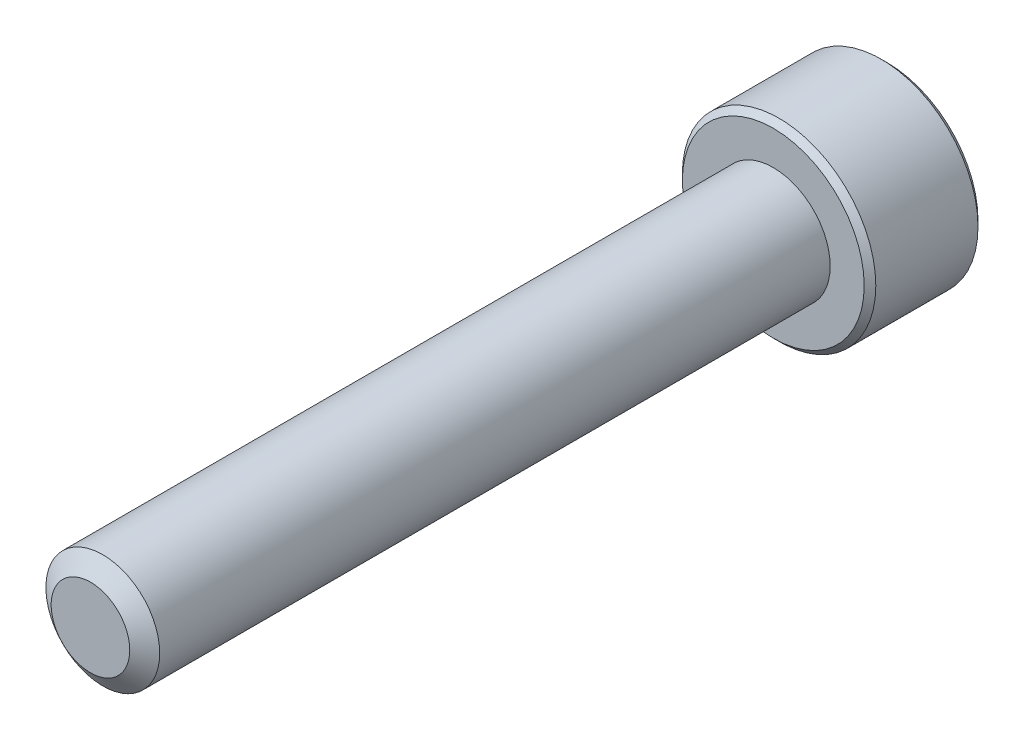
from build123d import *

# Parameters (mm, degrees)
SKETCH1_R          = 2.5
EXTRUDE1_DEPTH     = 30
SKETCH6_R          = 4.25
EXTRUDE2_DEPTH     = 5
CUT_EXTRUDE1_DEPTH = 3
CHAMFER1_SIZE      = 0.255


with BuildPart() as part:
    # Sketch1 → Extrude1 (new body)
    with BuildSketch(Plane.XY):
        Circle(SKETCH1_R)
    extrude(amount=-EXTRUDE1_DEPTH)

    # Sketch4 → Cut-Revolve1 (revolve, cut)
    with BuildSketch(Plane(origin=(0, 0, 0), x_dir=(0, 0, -1), z_dir=(1, 0, 0))):
        Polygon((0.541691224, 2.5), (0, 1.726384758), (0, 2.5), align=None)
    revolve(axis=Axis((0, 0, 0), (0, 0, -1)), mode=Mode.SUBTRACT)

    # Sketch6 → Extrude2 (add)
    with BuildSketch(Plane(origin=(0, 0, -30), x_dir=(-1, 0, 0), z_dir=(0, 0, -1))):
        Circle(SKETCH6_R)
    extrude(amount=EXTRUDE2_DEPTH)

    # Sketch7 → Cut-Extrude1 (cut)
    with BuildSketch(Plane(origin=(0, 0, -35), x_dir=(-1, 0, 0), z_dir=(0, 0, -1))):
        Polygon((0, 2.309401077), (-2, 1.154700538), (-2, -1.154700538), (0, -2.309401077), (2, -1.154700538), (2, 1.154700538), align=None)
    extrude(amount=-CUT_EXTRUDE1_DEPTH, mode=Mode.SUBTRACT)

    # Cut-Extrude2 cone 1 section (through the dimple's axis) → Cut-Extrude2 (revolve, cut)
    with BuildSketch(Plane(origin=(0, 0, -35), x_dir=(0, 1, 0), z_dir=(1, 0, 0))):
        Polygon((0, 0), (2.309401077, 0), (0, 2.309401077), align=None)
    revolve(axis=Axis((0, 0, -35), (0, 0, 1)), mode=Mode.SUBTRACT)

    # Chamfer1
    chamfer1_edges = [part.edges().sort_by_distance(p)[0] for p in [
        (4.25, 0, -35),
        (4.25, 0, -30),
    ]]
    chamfer(chamfer1_edges, length=CHAMFER1_SIZE)

    # Sketch10 → Revolve1 (revolve)
    with BuildSketch(Plane(origin=(0, 0, 0), x_dir=(0, 0, -1), z_dir=(1, 0, 0))):
        Polygon((30, 2.5), (30, 0), (28.764466094, 0), (29.8, 2.5), align=None)
    revolve(axis=Axis((0, 0, -30), (0, 0, 1)))


solid = part.part
